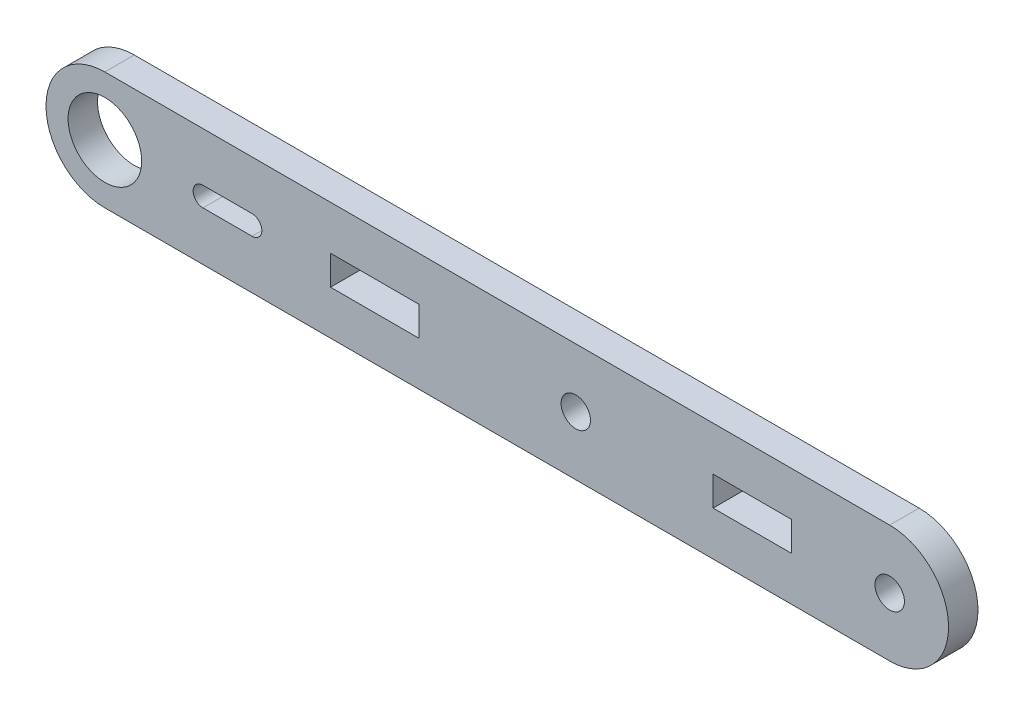
from build123d import *

# Parameters (mm, degrees)
ESQUISSE9_R        = 1.5
ESQUISSE9_R_2      = 3.75
ESQUISSE9_W        = 9
ESQUISSE9_H        = 3
ESQUISSE9_W_2      = 8
BOSS_EXTRU_9_DEPTH = 3


with BuildPart() as part:
    # Esquisse9 → Boss.-Extru.9 (new body)
    with BuildSketch(Plane.XY):
        with BuildLine():
            Line((-63.040292512, -47.505063948), (16.959707488, -47.505063948))
            ThreePointArc((16.959707488, -47.505063948), (22.959707488, -53.505063948), (16.959707488, -59.505063948))
            Line((16.959707488, -59.505063948), (-63.040292512, -59.505063948))
            ThreePointArc((-63.040292512, -59.505063948), (-69.040292512, -53.505063948), (-63.040292512, -47.505063948))
        make_face()
        with Locations((-15.040292512, -53.505063948)):
            Circle(ESQUISSE9_R, mode=Mode.SUBTRACT)
        with Locations((16.959707488, -53.505063948)):
            Circle(ESQUISSE9_R, mode=Mode.SUBTRACT)
        with Locations((-63.040292512, -53.505063948)):
            Circle(ESQUISSE9_R_2, mode=Mode.SUBTRACT)
        with Locations((-35.540292512, -53.505063948)):
            Rectangle(ESQUISSE9_W, ESQUISSE9_H, mode=Mode.SUBTRACT)
        with Locations((2.959707488, -53.505063948)):
            Rectangle(ESQUISSE9_W_2, ESQUISSE9_H, mode=Mode.SUBTRACT)
        with BuildLine():
            Line((-53.040292512, -52.505063948), (-48.040292512, -52.505063948))
            ThreePointArc((-48.040292512, -52.505063948), (-47.040292512, -53.505063948), (-48.040292512, -54.505063948))
            Line((-48.040292512, -54.505063948), (-53.040292512, -54.505063948))
            ThreePointArc((-53.040292512, -54.505063948), (-54.040292512, -53.505063948), (-53.040292512, -52.505063948))
        make_face(mode=Mode.SUBTRACT)
    extrude(amount=BOSS_EXTRU_9_DEPTH)


solid = part.part
